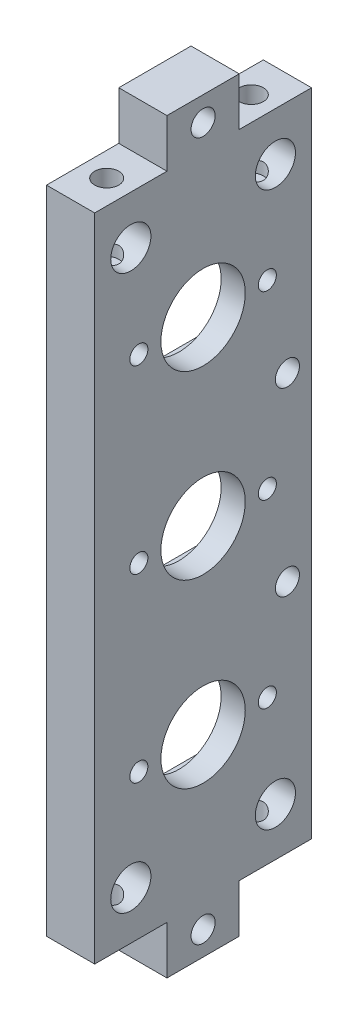
from build123d import *

# Parameters (mm, degrees)
SKETCH2_W            = 54
SKETCH2_H            = 162
SKETCH2_R            = 10.5
BOSS_EXTRUDE1_DEPTH  = 12
SKETCH3_W            = 18
SKETCH3_H            = 12
BOSS_EXTRUDE2_DEPTH  = 12
CUT_EXTRUDE1_REACH   = 99.581
SKETCH4_R            = 2.25
LPATTERN1_COUNT      = 3
LPATTERN1_PITCH      = 45
CUT_EXTRUDE2_DEPTH   = 6
LPATTERN2_COUNT      = 2
LPATTERN2_PITCH      = 45
LPATTERN2_COUNT_DIR2 = 2
LPATTERN2_PITCH_DIR2 = 45
CUT_EXTRUDE3_REACH   = 99.581
SKETCH6_R            = 5
SKETCH8_R            = 5
CUT_EXTRUDE4_DEPTH   = 6
CUT_EXTRUDE5_REACH   = 99.026
SKETCH9_R            = 3
SKETCH10_R           = 3
CUT_EXTRUDE6_DEPTH   = 19
CUT_EXTRUDE7_REACH   = 99.581
SKETCH11_R           = 3
CUT_EXTRUDE8_DEPTH   = 6


with BuildPart() as part:
    # Sketch2 → Boss-Extrude1 (new body)
    with BuildSketch(Plane(origin=(0, 0, 0), x_dir=(0, 0, -1), z_dir=(1, 0, 0))):
        Rectangle(SKETCH2_W, SKETCH2_H)
        Circle(SKETCH2_R, mode=Mode.SUBTRACT)
        with Locations((0, 45)):
            Circle(SKETCH2_R, mode=Mode.SUBTRACT)
        with Locations((0, -45)):
            Circle(SKETCH2_R, mode=Mode.SUBTRACT)
    extrude(amount=BOSS_EXTRUDE1_DEPTH)

    # Sketch3 → Boss-Extrude2 (add)
    with BuildSketch(Plane(origin=(12, 0, 0), x_dir=(0, 0, -1), z_dir=(1, 0, 0))):
        with Locations((0, -87)):
            Rectangle(SKETCH3_W, SKETCH3_H)
    boss_extrude2 = extrude(amount=-BOSS_EXTRUDE2_DEPTH)

    # Mirror1: Boss-Extrude2 across plane
    add(boss_extrude2.mirror(Plane.ZX))

    # Sketch4 → Cut-Extrude1 (cut, up to next)
    with BuildSketch(Plane(origin=(12, 0, 0), x_dir=(0, 0, -1), z_dir=(1, 0, 0)), mode=Mode.PRIVATE) as cut_extrude1_sk1:
        with Locations((-16, -45)):
            Circle(SKETCH4_R)
    cut_extrude1_tool1 = extrude(cut_extrude1_sk1.sketch, amount=-CUT_EXTRUDE1_REACH, mode=Mode.PRIVATE) & part.part
    # Sketch4 → Cut-Extrude1 (cut, up to next)
    with BuildSketch(Plane(origin=(12, 0, 0), x_dir=(0, 0, -1), z_dir=(1, 0, 0)), mode=Mode.PRIVATE) as cut_extrude1_sk2:
        with Locations((16, -45)):
            Circle(SKETCH4_R)
    cut_extrude1_tool2 = extrude(cut_extrude1_sk2.sketch, amount=-CUT_EXTRUDE1_REACH, mode=Mode.PRIVATE) & part.part
    cut_extrude1_1 = cut_extrude1_tool1.solids().sort_by_distance((12, -45, 16))[0]
    add(cut_extrude1_1, mode=Mode.SUBTRACT)
    cut_extrude1_2 = cut_extrude1_tool2.solids().sort_by_distance((12, -45, -16))[0]
    add(cut_extrude1_2, mode=Mode.SUBTRACT)
    cut_extrude1 = cut_extrude1_1 + cut_extrude1_2  # Cut-Extrude1 as one shape, for the pattern or mirror that repeats it

    # LPattern1: Cut-Extrude1 ×3
    with Locations(*[(0, i * LPATTERN1_PITCH, 0) for i in range(1, LPATTERN1_COUNT)]):
        add(cut_extrude1, mode=Mode.SUBTRACT)

    # Sketch5 → Cut-Extrude2 (cut)
    with BuildSketch(Plane.ZY):
        with BuildLine():
            Line((-16.992645468, 15.5), (16.992645468, 15.5))
            ThreePointArc((16.992645468, 15.5), (23, 0), (16.992645468, -15.5))
            Line((16.992645468, -15.5), (-16.992645468, -15.5))
            ThreePointArc((-16.992645468, -15.5), (-23, 0), (-16.992645468, 15.5))
        make_face()
    cut_extrude2 = extrude(amount=-CUT_EXTRUDE2_DEPTH, mode=Mode.SUBTRACT)

    # LPattern2: Cut-Extrude2 2 × 2
    with Locations(*[Vector(0, -1, 0) * (i * LPATTERN2_PITCH) + Vector(0, 1, 0) * (j * LPATTERN2_PITCH_DIR2) for i in range(LPATTERN2_COUNT) for j in range(LPATTERN2_COUNT_DIR2) if (i, j) != (0, 0)]):
        add(cut_extrude2, mode=Mode.SUBTRACT)

    # Sketch6 → Cut-Extrude3 (cut, up to next)
    with BuildSketch(Plane.ZY, mode=Mode.PRIVATE) as cut_extrude3_sk1:
        with Locations((-18, -69)):
            Circle(SKETCH6_R)
    cut_extrude3_tool1 = extrude(cut_extrude3_sk1.sketch, amount=-CUT_EXTRUDE3_REACH, mode=Mode.PRIVATE) & part.part
    # Sketch6 → Cut-Extrude3 (cut, up to next)
    with BuildSketch(Plane.ZY, mode=Mode.PRIVATE) as cut_extrude3_sk2:
        with Locations((18, -69)):
            Circle(SKETCH6_R)
    cut_extrude3_tool2 = extrude(cut_extrude3_sk2.sketch, amount=-CUT_EXTRUDE3_REACH, mode=Mode.PRIVATE) & part.part
    cut_extrude3_1 = cut_extrude3_tool1.solids().sort_by_distance((0, -69, -18))[0]
    add(cut_extrude3_1, mode=Mode.SUBTRACT)
    cut_extrude3_2 = cut_extrude3_tool2.solids().sort_by_distance((0, -69, 18))[0]
    add(cut_extrude3_2, mode=Mode.SUBTRACT)
    cut_extrude3 = cut_extrude3_1 + cut_extrude3_2  # Cut-Extrude3 as one shape, for the pattern or mirror that repeats it

    # Sketch8 → Cut-Extrude4 (cut)
    with BuildSketch(Plane.ZY):
        with Locations((0, -87)):
            Circle(SKETCH8_R)
    cut_extrude4 = extrude(amount=-CUT_EXTRUDE4_DEPTH, mode=Mode.SUBTRACT)

    # Sketch9 → Cut-Extrude5 (cut, up to next)
    with BuildSketch(Plane.ZY.offset(-6), mode=Mode.PRIVATE) as cut_extrude5_sk1:
        with Locations((0, -87)):
            Circle(SKETCH9_R)
    cut_extrude5_tool1 = extrude(cut_extrude5_sk1.sketch, amount=-CUT_EXTRUDE5_REACH, mode=Mode.PRIVATE) & part.part
    cut_extrude5 = cut_extrude5_tool1.solids().sort_by_distance((6, -87, 0))[0]
    add(cut_extrude5, mode=Mode.SUBTRACT)

    # Sketch10 → Cut-Extrude6 (cut)
    with BuildSketch(Plane.XZ.offset(81)):
        with Locations((6, -18)):
            Circle(SKETCH10_R)
        with Locations((6, 18)):
            Circle(SKETCH10_R)
    cut_extrude6 = extrude(amount=-CUT_EXTRUDE6_DEPTH, mode=Mode.SUBTRACT)

    # Sketch11 → Cut-Extrude7 (cut, up to next)
    with BuildSketch(Plane.ZY, mode=Mode.PRIVATE) as cut_extrude7_sk1:
        with Locations((-21, -22.5)):
            Circle(SKETCH11_R)
    cut_extrude7_tool1 = extrude(cut_extrude7_sk1.sketch, amount=-CUT_EXTRUDE7_REACH, mode=Mode.PRIVATE) & part.part
    cut_extrude7 = cut_extrude7_tool1.solids().sort_by_distance((0, -22.5, -21))[0]
    add(cut_extrude7, mode=Mode.SUBTRACT)

    # Sketch12 → Cut-Extrude8 (cut)
    with BuildSketch(Plane.ZY):
        with BuildLine():
            Line((-21, -27.5), (-27, -27.5))
            Line((-27, -27.5), (-27, -17.5))
            Line((-27, -17.5), (-21, -17.5))
            ThreePointArc((-21, -17.5), (-16, -22.5), (-21, -27.5))
        make_face()
    cut_extrude8 = extrude(amount=-CUT_EXTRUDE8_DEPTH, mode=Mode.SUBTRACT)

    # Mirror2: Cut-Extrude3, Cut-Extrude4, Cut-Extrude5, Cut-Extrude6, Cut-Extrude7, Cut-Extrude8 across plane
    add(cut_extrude3.mirror(Plane.ZX), mode=Mode.SUBTRACT)
    add(cut_extrude4.mirror(Plane.ZX), mode=Mode.SUBTRACT)
    add(cut_extrude5.mirror(Plane.ZX), mode=Mode.SUBTRACT)
    add(cut_extrude6.mirror(Plane.ZX), mode=Mode.SUBTRACT)
    add(cut_extrude7.mirror(Plane.ZX), mode=Mode.SUBTRACT)
    add(cut_extrude8.mirror(Plane.ZX), mode=Mode.SUBTRACT)


solid = part.part
